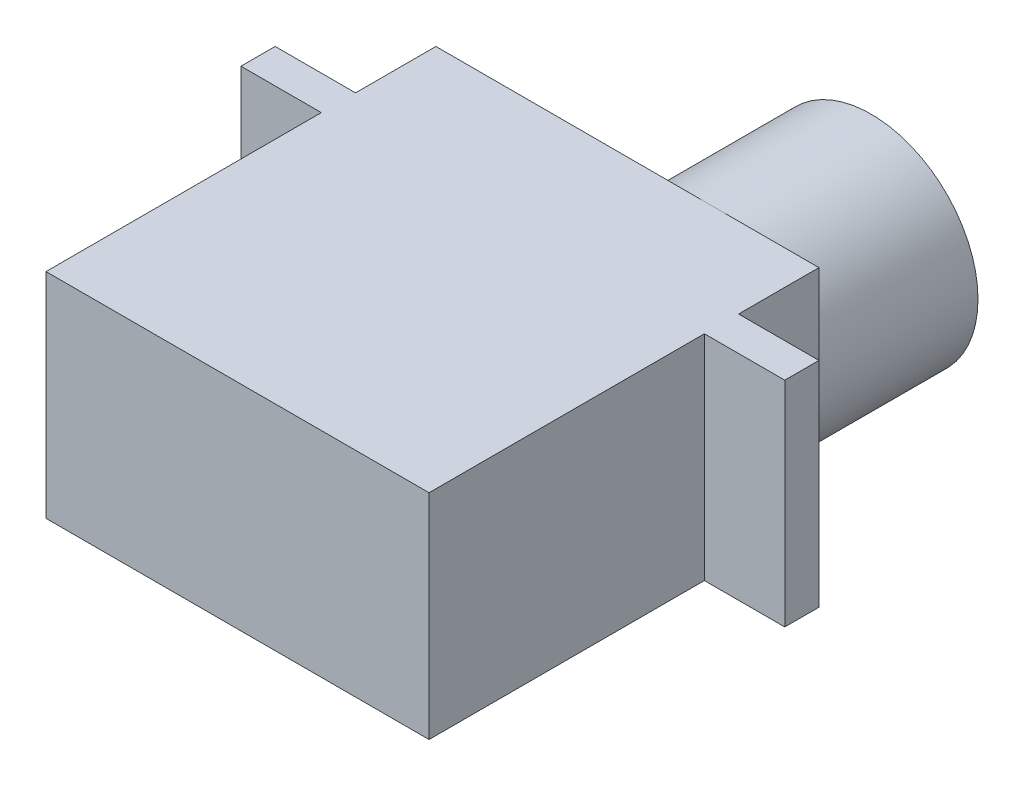
from build123d import *

# Parameters (mm, degrees)
SKETCH_1_W      = 22.4
SKETCH_1_H      = 12.5
EXTRUDE_1_DEPTH = 16.1
SKETCH_2_W      = 31.8
SKETCH_2_H      = 12.5
EXTRUDE_2_DEPTH = 2
SKETCH_3_W      = 22.4
SKETCH_3_H      = 12.5
EXTRUDE_3_DEPTH = 4.7
SKETCH_4_R      = 6.25
EXTRUDE_4_DEPTH = 9.3


with BuildPart() as part:
    # 草图1 → 凸台-拉伸1 (new body)
    with BuildSketch(Plane.XY):
        Rectangle(SKETCH_1_W, SKETCH_1_H)
    extrude(amount=EXTRUDE_1_DEPTH)

    # 草图2 → 凸台-拉伸2 (add)
    with BuildSketch(Plane(origin=(0, 0, 0), x_dir=(-1, 0, 0), z_dir=(0, 0, -1))):
        Rectangle(SKETCH_2_W, SKETCH_2_H)
    extrude(amount=EXTRUDE_2_DEPTH)

    # 草图3 → 凸台-拉伸3 (add)
    with BuildSketch(Plane(origin=(0, 0, -2), x_dir=(-1, 0, 0), z_dir=(0, 0, -1))):
        Rectangle(SKETCH_3_W, SKETCH_3_H)
    extrude(amount=EXTRUDE_3_DEPTH)

    # 草图4 → 凸台-拉伸4 (add)
    with BuildSketch(Plane(origin=(0, 0, -6.7), x_dir=(-1, 0, 0), z_dir=(0, 0, -1))):
        with Locations(Location((-4.95, 0, 0), (0, 0, 180))):
            Circle(SKETCH_4_R)
    extrude(amount=EXTRUDE_4_DEPTH)


solid = part.part
